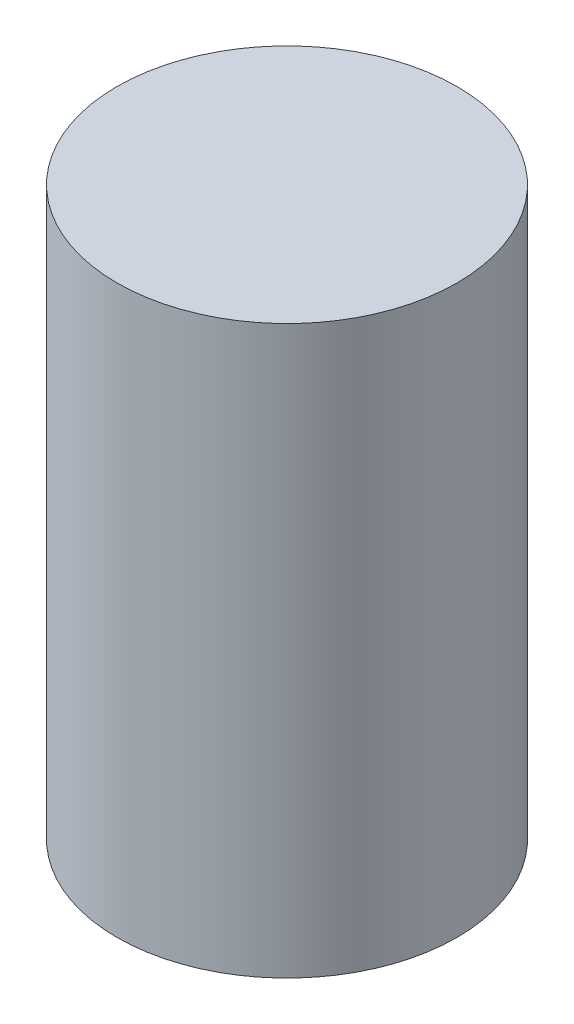
from build123d import *

# Parameters (mm, degrees)
STORE_SOG2_KOMPRESOR_START = 1680
SKETCH1_R                  = 60
STORE_SOG2_KOMPRESOR_DEPTH = 200


with BuildPart() as part:
    # Sketch1 → STORE_sog2_kompresor (new body)
    with BuildSketch(Plane(origin=(0, 0, 0), x_dir=(1, 0, 0), z_dir=(0, 1, 0)).offset(STORE_SOG2_KOMPRESOR_START)):
        with Locations(Location((820, 200, 0), (0, 0, 270))):
            Circle(SKETCH1_R)
    extrude(amount=STORE_SOG2_KOMPRESOR_DEPTH)


solid = part.part
